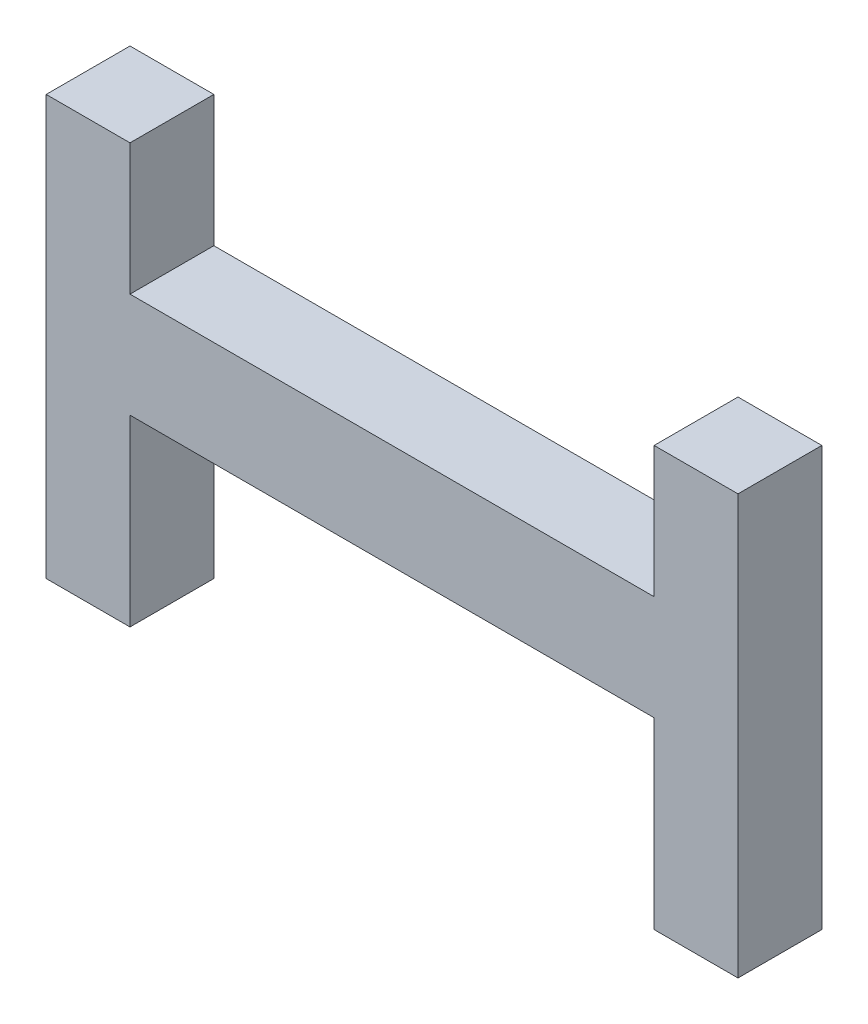
from build123d import *

# Parameters (mm, degrees)
BOSS_EXTRUDE1_DEPTH = 1.6


with BuildPart() as part:
    # Sketch1 → Boss-Extrude1 (new body)
    with BuildSketch(Plane.XY):
        Polygon((8.825073242, 4), (8.825073242, -4), (7.224975586, -4), (7.224975586, -0.5), (-2.775024414, -0.5), (-2.775024414, -4), (-4.375, -4), (-4.375, 4), (-2.775024414, 4), (-2.775024414, 1.5), (7.224975586, 1.5), (7.224975586, 4), align=None)
    extrude(amount=BOSS_EXTRUDE1_DEPTH)


solid = part.part
